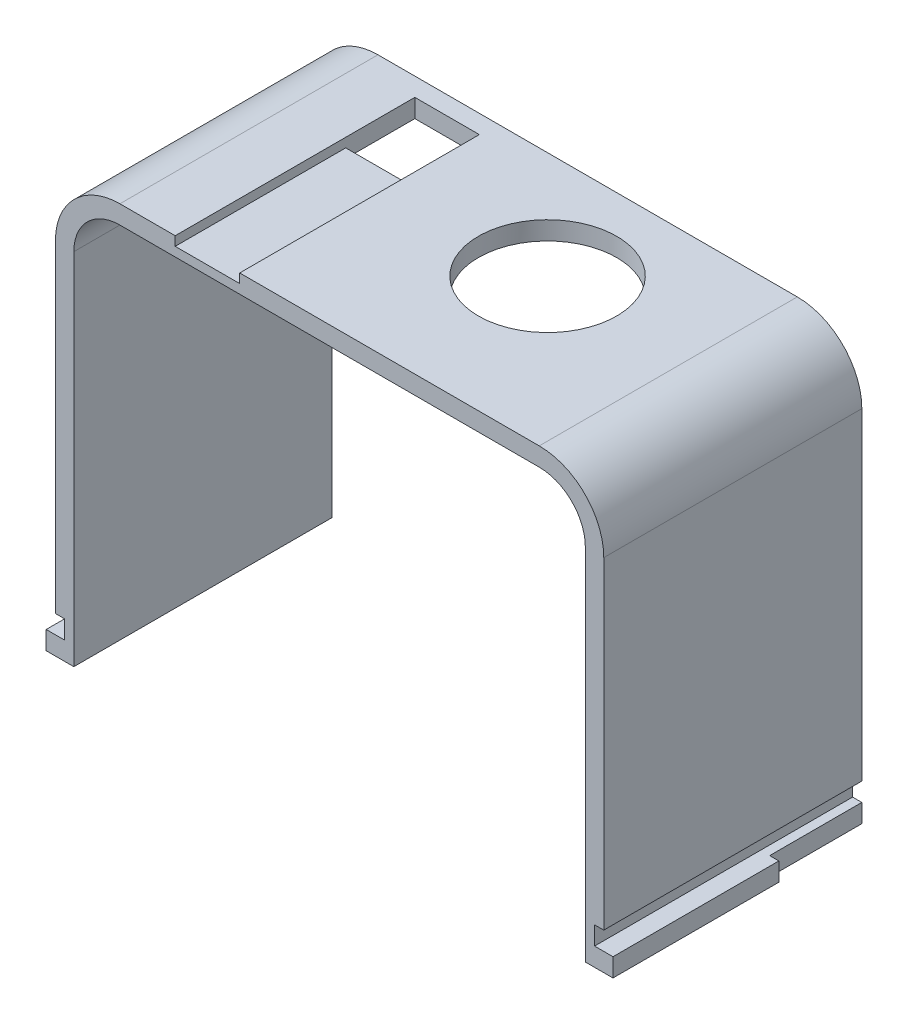
from build123d import *

# Parameters (mm, degrees)
BOSS_EXTRUDE1_DEPTH = 28
SKETCH2_W           = 1
SKETCH2_H           = 2
BOSS_EXTRUDE2_DEPTH = 28
SKETCH3_W           = 1
SKETCH3_H           = 2
CUT_EXTRUDE1_DEPTH  = 60.264016753
SKETCH4_R           = 7.5
CUT_EXTRUDE2_DEPTH  = 10
SKETCH5_W           = 1
SKETCH5_H           = 2
CUT_EXTRUDE3_DEPTH  = 10
SKETCH6_W           = 7
SKETCH6_H           = 7.5
CUT_EXTRUDE4_DEPTH  = 2
SKETCH7_W           = 7
SKETCH7_H           = 18.5
CUT_EXTRUDE5_DEPTH  = 1


with BuildPart() as part:
    # Sketch1 → Boss-Extrude1 (new body)
    with BuildSketch(Plane.XY):
        with BuildLine():
            Line((-30.589041096, 0), (-30.589041096, 33))
            ThreePointArc((-30.589041096, 33), (-29.124575002, 36.535533906), (-25.589041096, 38))
            Line((-25.589041096, 38), (19.910958904, 38))
            ThreePointArc((19.910958904, 38), (23.44649281, 36.535533906), (24.910958904, 33))
            Line((24.910958904, 33), (24.910958904, 0))
            Line((24.910958904, 0), (24.910958904, -6))
            Line((24.910958904, -6), (26.910958904, -6))
            Line((26.910958904, -6), (26.910958904, 0))
            Line((26.910958904, 0), (26.910958904, 33))
            ThreePointArc((26.910958904, 33), (24.860706372, 37.949747468), (19.910958904, 40))
            Line((19.910958904, 40), (-25.589041096, 40))
            ThreePointArc((-25.589041096, 40), (-30.538788564, 37.949747468), (-32.589041096, 33))
            Line((-32.589041096, 33), (-32.589041096, 0))
            Line((-32.589041096, 0), (-32.589041096, -6))
            Line((-32.589041096, -6), (-30.589041096, -6))
            Line((-30.589041096, -6), (-30.589041096, 0))
        make_face()
    extrude(amount=BOSS_EXTRUDE1_DEPTH)

    # Sketch2 → Boss-Extrude2 (add, through all)
    with BuildSketch(Plane.XY.offset(28)):
        with Locations((-33.089041096, -5)):
            Rectangle(SKETCH2_W, SKETCH2_H)
        with Locations((27.410958904, -5)):
            Rectangle(SKETCH2_W, SKETCH2_H)
    extrude(amount=-BOSS_EXTRUDE2_DEPTH)

    # Sketch3 → Cut-Extrude1 (cut, through all)
    with BuildSketch(Plane.XY.offset(28)):
        with Locations((-32.089041096, -3)):
            Rectangle(SKETCH3_W, SKETCH3_H)
        with Locations((26.410958904, -3)):
            Rectangle(SKETCH3_W, SKETCH3_H)
    extrude(amount=-CUT_EXTRUDE1_DEPTH, mode=Mode.SUBTRACT)

    # Sketch4 → Cut-Extrude2 (cut)
    with BuildSketch(Plane(origin=(0, 40, 0), x_dir=(1, 0, 0), z_dir=(0, 1, 0))):
        with Locations(Location((4.410958904, -11.6, 0), (0, 0, 270))):
            Circle(SKETCH4_R)
    extrude(amount=-CUT_EXTRUDE2_DEPTH, mode=Mode.SUBTRACT)

    # Sketch5 → Cut-Extrude3 (cut)
    with BuildSketch(Plane(origin=(0, 0, 0), x_dir=(-1, 0, 0), z_dir=(0, 0, -1))):
        with Locations((-27.410958904, -5)):
            Rectangle(SKETCH5_W, SKETCH5_H)
    extrude(amount=-CUT_EXTRUDE3_DEPTH, mode=Mode.SUBTRACT)

    # Sketch6 → Cut-Extrude4 (cut)
    with BuildSketch(Plane(origin=(0, 40, 0), x_dir=(1, 0, 0), z_dir=(0, 1, 0))):
        with Locations((-16.089041096, -5.75)):
            Rectangle(SKETCH6_W, SKETCH6_H)
    extrude(amount=-CUT_EXTRUDE4_DEPTH, mode=Mode.SUBTRACT)

    # Sketch7 → Cut-Extrude5 (cut)
    with BuildSketch(Plane(origin=(0, 40, 0), x_dir=(1, 0, 0), z_dir=(0, 1, 0))):
        with Locations((-16.089041096, -18.75)):
            Rectangle(SKETCH7_W, SKETCH7_H)
    extrude(amount=-CUT_EXTRUDE5_DEPTH, mode=Mode.SUBTRACT)


solid = part.part
